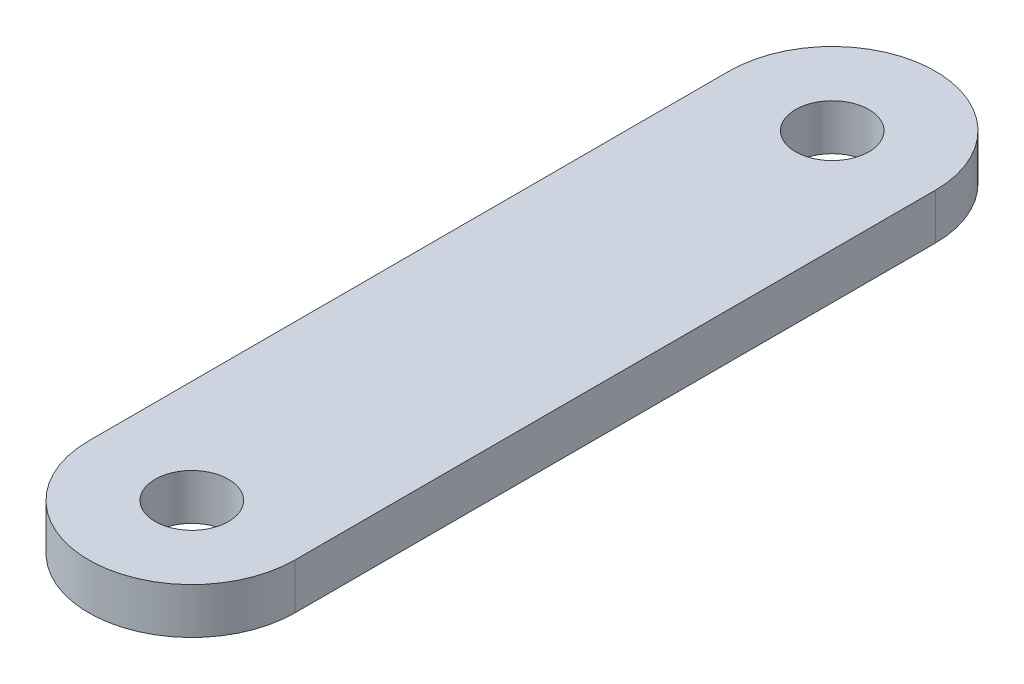
from build123d import *

# Parameters (mm, degrees)
SKETCH1_R           = 4.5
SKETCH1_W           = 9
SKETCH1_H           = 27.94
BOSS_EXTRUDE1_DEPTH = 2
SKETCH2_R           = 1.6
CUT_EXTRUDE1_DEPTH  = 10


with BuildPart() as part:
    # Sketch1 → Boss-Extrude1 (new body)
    with BuildSketch(Plane(origin=(0, 0, 0), x_dir=(1, 0, 0), z_dir=(0, 1, 0))):
        Circle(SKETCH1_R)
        with Locations((0, -27.94)):
            Circle(SKETCH1_R)
        with Locations((0, -13.97)):
            Rectangle(SKETCH1_W, SKETCH1_H)
    extrude(amount=BOSS_EXTRUDE1_DEPTH)

    # Sketch2 → Cut-Extrude1 (cut)
    with BuildSketch(Plane(origin=(0, 2, 0), x_dir=(1, 0, 0), z_dir=(0, 1, 0))):
        with Locations(Location((0, 0, 0), (0, 0, 270))):
            Circle(SKETCH2_R)
        with Locations(Location((0, -27.94, 0), (0, 0, 270))):
            Circle(SKETCH2_R)
    extrude(amount=-CUT_EXTRUDE1_DEPTH, mode=Mode.SUBTRACT)


solid = part.part
